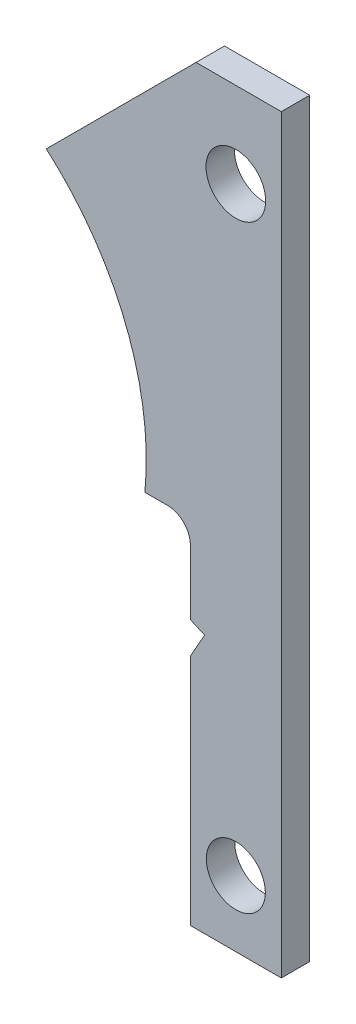
from build123d import *

# Parameters (mm, degrees)
MODEL_R             = 5.191903136
MODEL_R_2           = 5.25
BOSS_EXTRUDE1_DEPTH = 5
BOSS_EXTRUDE2_DEPTH = 5
SKETCH3_R           = 51.25
CUT_EXTRUDE1_DEPTH  = 6


with BuildPart() as part:
    # Model → Boss-Extrude1 (new body)
    with BuildSketch(Plane.XY):
        with BuildLine():
            Line((869.6, 129.800004709), (854.6, 129.800004709))
            Line((854.6, 129.800004709), (854.6, 124.800004709))
            ThreePointArc((854.6, 124.800004709), (842.940279, 95.005240735), (815.123335737, 79.19718198))
            ThreePointArc((815.123335737, 79.19718198), (819.577050566, 70.004649675), (820.028101645, 59.800004709))
            Line((820.028101645, 59.800004709), (849.60000149, 59.800004709))
            ThreePointArc((849.60000149, 59.800004709), (852.428428615, 58.628431833), (853.60000149, 55.800004709))
            Line((853.60000149, 55.800004709), (853.60000149, 44.400154403))
            Line((853.60000149, 44.400154403), (856.099999799, 43.300004388))
            Line((856.099999799, 43.300004388), (853.60000149, 38.829377357))
            Line((853.60000149, 38.829377357), (853.60000149, -2.199993903))
            Line((853.60000149, -2.199993903), (869.6, -2.199993903))
            Line((869.6, -2.199993903), (869.6, 129.800004709))
        make_face()
        with Locations((861.6, 9.391497171)):
            Circle(MODEL_R, mode=Mode.SUBTRACT)
        with Locations((861.6, 114.800004709)):
            Circle(MODEL_R_2, mode=Mode.SUBTRACT)
    extrude(amount=BOSS_EXTRUDE1_DEPTH)

    # Sketch4 → Boss-Extrude2 (add)
    with BuildSketch(Plane.XY):
        Polygon((854.6, 129.800004709), (799.700462268, 74.900466976), (857.081865671, 78.451748184), (855.676639351, 119.436170701), (858.647890459, 128.484980891), align=None)
    extrude(amount=BOSS_EXTRUDE2_DEPTH)

    # Sketch3 → Cut-Extrude1 (cut)
    with BuildSketch(Plane(origin=(0, 0, 0), x_dir=(-1, 0, 0), z_dir=(0, 0, -1))):
        with Locations((-794.6, 64.800004709)):
            Circle(SKETCH3_R)
    extrude(amount=-CUT_EXTRUDE1_DEPTH, mode=Mode.SUBTRACT)


solid = part.part
